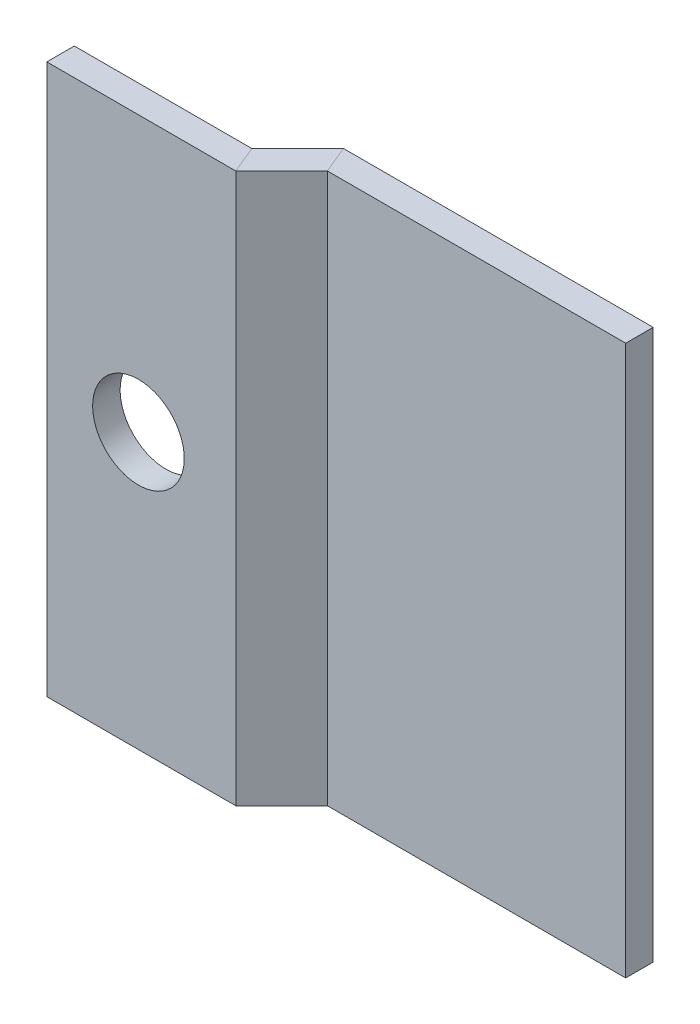
from build123d import *

# Parameters (mm, degrees)
SKETCH2_W          = 0.6
SKETCH2_H          = 12
SKETCH3_R          = 1
CUT_EXTRUDE1_DEPTH = 0.6


with BuildPart() as part:
    # Sweep1: sweep along a path in Sketch1
    with BuildLine(Plane(origin=(0, 0, 0), x_dir=(1, 0, 0), z_dir=(0, 1, 0))) as sweep1_path:
        Line((0, 0), (4, 0))
        Line((4, 0), (5, 1))
        Line((5, 1), (11.635544966, 1))
    # Sketch2 → Sweep1 (sweep)
    with BuildSketch(Plane(origin=(0, 0, 0), x_dir=(0, 0, -1), z_dir=(1, 0, 0))):
        Rectangle(SKETCH2_W, SKETCH2_H)
    sweep(path=sweep1_path.line, transition=Transition.RIGHT)

    # Sketch3 → Cut-Extrude1 (cut)
    with BuildSketch(Plane(origin=(0, 0, -0.3), x_dir=(-1, 0, 0), z_dir=(0, 0, -1))):
        with Locations(Location((-2, 0, 0), (0, 0, 90))):
            Circle(SKETCH3_R)
    extrude(amount=-CUT_EXTRUDE1_DEPTH, mode=Mode.SUBTRACT)


solid = part.part
